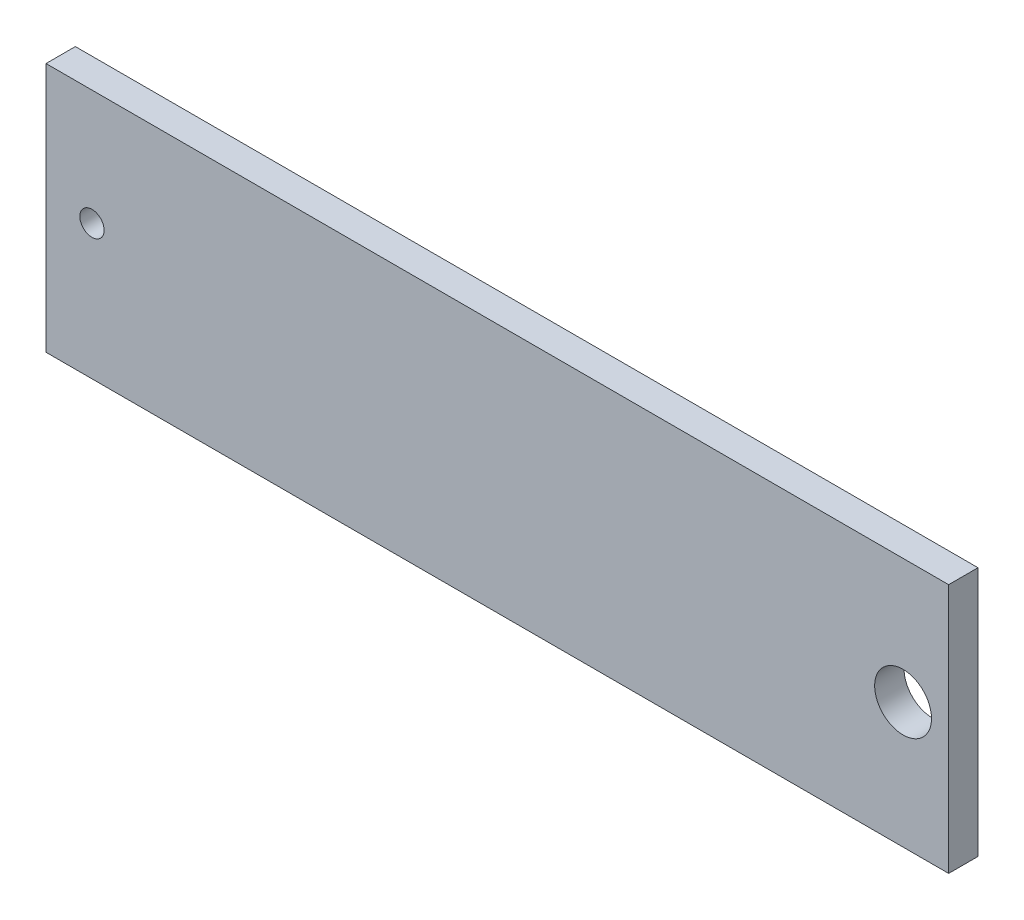
from build123d import *

# Parameters (mm, degrees)
SKETCH1_W           = 307.464041157
SKETCH1_H           = 85.186770425
BOSS_EXTRUDE1_DEPTH = 10
SKETCH2_R           = 4.139285717
SKETCH2_R_2         = 9.682173213
CUT_EXTRUDE1_DEPTH  = 10


with BuildPart() as part:
    # Sketch1 → Boss-Extrude1 (new body)
    with BuildSketch(Plane.XY):
        with Locations((29.390884217, 18.76909814)):
            Rectangle(SKETCH1_W, SKETCH1_H)
    extrude(amount=BOSS_EXTRUDE1_DEPTH)

    # Sketch2 → Cut-Extrude1 (cut)
    with BuildSketch(Plane.XY.offset(10)):
        with Locations((-108.689704377, 22.047962032)):
            Circle(SKETCH2_R)
        with Locations((167.601690812, 18.943497555)):
            Circle(SKETCH2_R_2)
    extrude(amount=-CUT_EXTRUDE1_DEPTH, mode=Mode.SUBTRACT)


solid = part.part
